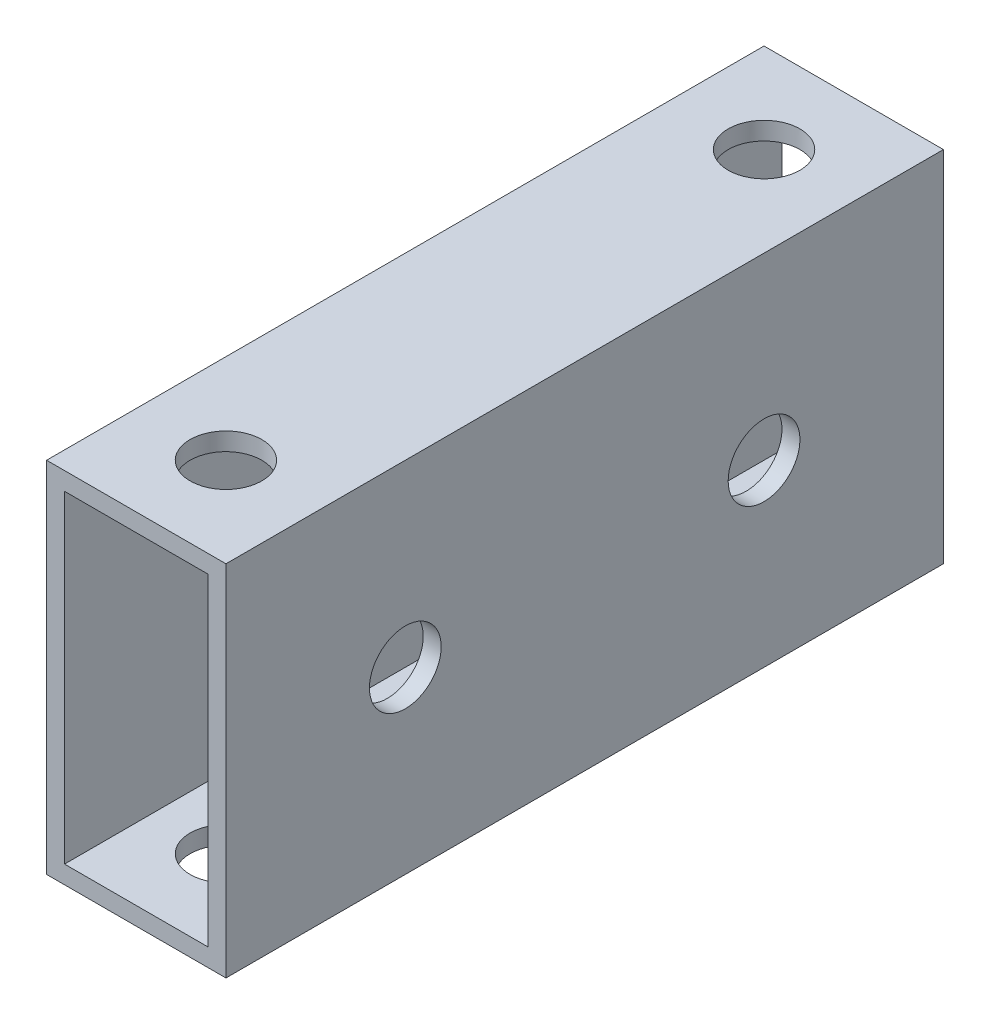
from build123d import *

# Parameters (mm, degrees)
SKETCH_1_W          = 10
SKETCH_1_H          = 20
SKETCH_1_W_2        = 8
SKETCH_1_H_2        = 18
EXTRUDE_1_DEPTH     = 40
SKETCH_2_R          = 2
CUT_EXTRUDE_1_DEPTH = 43.426406871
SKETCH_3_R          = 2
CUT_EXTRUDE_2_DEPTH = 46


with BuildPart() as part:
    # ｽｹｯﾁ1 → 押し出し-薄板1 (new body)
    with BuildSketch(Plane.XY):
        Rectangle(SKETCH_1_W, SKETCH_1_H)
        Rectangle(SKETCH_1_W_2, SKETCH_1_H_2, mode=Mode.SUBTRACT)
    extrude(amount=EXTRUDE_1_DEPTH)

    # ｽｹｯﾁ2 → ｶｯﾄ - 押し出し1 (cut, through all)
    with BuildSketch(Plane.ZY.offset(5)):
        with Locations((10, 0)):
            Circle(SKETCH_2_R)
        with Locations((30, 0)):
            Circle(SKETCH_2_R)
    extrude(amount=-CUT_EXTRUDE_1_DEPTH, mode=Mode.SUBTRACT)

    # ｽｹｯﾁ3 → ｶｯﾄ - 押し出し2 (cut, through all)
    with BuildSketch(Plane(origin=(0, 10, 0), x_dir=(1, 0, 0), z_dir=(0, 1, 0))):
        with Locations(Location((0, -5, 0), (0, 0, 270))):
            Circle(SKETCH_3_R)
        with Locations(Location((0, -35, 0), (0, 0, 90))):
            Circle(SKETCH_3_R)
    extrude(amount=-CUT_EXTRUDE_2_DEPTH, mode=Mode.SUBTRACT)


solid = part.part
